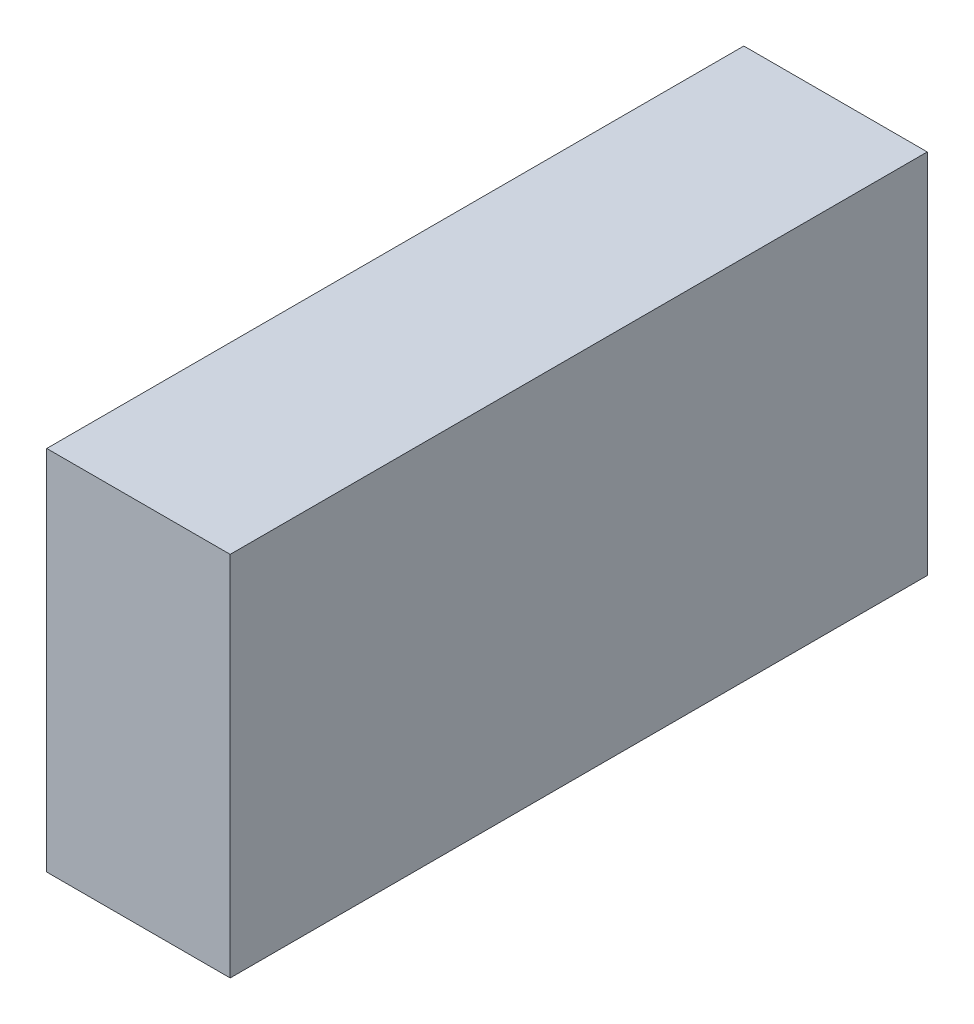
from build123d import *

# Parameters (mm, degrees)
SKETCH1_W           = 48.26
SKETCH1_H           = 25.4
BOSS_EXTRUDE1_DEPTH = 12.7


with BuildPart() as part:
    # Sketch1 → Boss-Extrude1 (new body)
    with BuildSketch(Plane(origin=(0, 0, 0), x_dir=(0, 0, -1), z_dir=(1, 0, 0))):
        with Locations((24.13, 12.7)):
            Rectangle(SKETCH1_W, SKETCH1_H)
    extrude(amount=BOSS_EXTRUDE1_DEPTH)


solid = part.part
